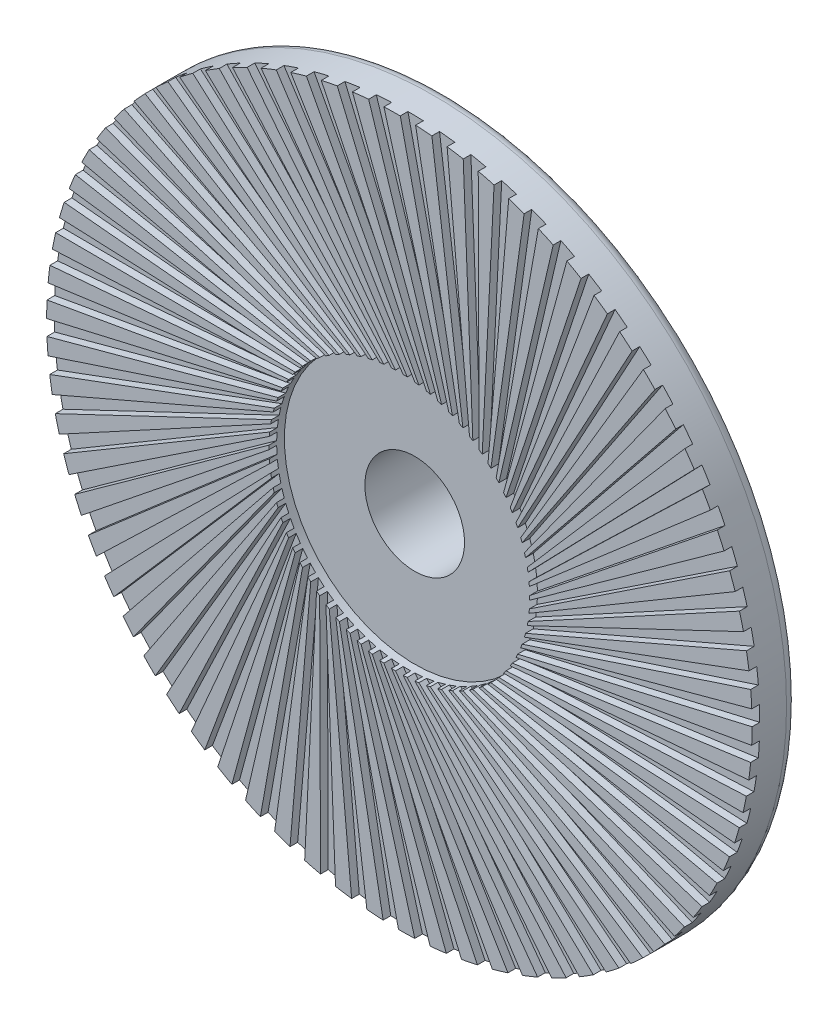
from build123d import *

# Parameters (mm, degrees)
CROQUIS1_R              = 46
SALIENTE_EXTRUIR1_DEPTH = 6
CORTAR_EXTRUIR1_START   = -1
CORTAR_EXTRUIR1_DEPTH   = 1
MATRIZC1_COUNT          = 70
CORTAR_EXTRUIR2_START   = -2
CROQUIS3_R              = 17
CORTAR_EXTRUIR2_DEPTH   = 2
CROQUIS4_R              = 14
SALIENTE_EXTRUIR2_DEPTH = 7
CROQUIS5_R              = 6.5
CORTAR_EXTRUIR3_DEPTH   = 67.340033162
REDONDEO1_R             = 2
CROQUIS6_R              = 1.5
CORTAR_EXTRUIR5_DEPTH   = 15
REDONDEO2_R             = 1.5
REDONDEO3_R             = 1.5
MATRIZC2_COUNT          = 2
MATRIZC2_ANGLE          = 90


with BuildPart() as part:
    # Croquis1 → Saliente-Extruir1 (new body)
    with BuildSketch(Plane.XY):
        Circle(CROQUIS1_R)
    extrude(amount=SALIENTE_EXTRUIR1_DEPTH)

    # Croquis2 → Cortar-Extruir1 (cut)
    with BuildSketch(Plane.XY.offset(6).offset(CORTAR_EXTRUIR1_START)):
        with BuildLine():
            Line((-0.5, 18.359265396), (-18.031751212, 42.318505978))
            ThreePointArc((-18.031751212, 42.318505978), (-18.947457419, 41.916510558), (-19.854208193, 41.494703482))
            Line((-19.854208193, 41.494703482), (-0.5, 16.992645468))
            ThreePointArc((-0.5, 16.992645468), (0, 17), (0.5, 16.992645468))
            Line((0.5, 16.992645468), (-0.5, 18.359265396))
        make_face()
    cortar_extruir1 = extrude(amount=CORTAR_EXTRUIR1_DEPTH, mode=Mode.SUBTRACT)

    # MatrizC1: Cortar-Extruir1 ×70 about axis
    matrizc1_axis = Axis((0, 0, 0), (0, 0, 1))
    for i in range(1, MATRIZC1_COUNT):
        add(cortar_extruir1.rotate(matrizc1_axis, i * 360 / MATRIZC1_COUNT), mode=Mode.SUBTRACT)

    # Croquis3 → Cortar-Extruir2 (cut)
    with BuildSketch(Plane.XY.offset(6).offset(CORTAR_EXTRUIR2_START)):
        Circle(CROQUIS3_R)
    extrude(amount=CORTAR_EXTRUIR2_DEPTH, mode=Mode.SUBTRACT)

    # Croquis4 → Saliente-Extruir2 (add)
    with BuildSketch(Plane(origin=(0, 0, 0), x_dir=(-1, 0, 0), z_dir=(0, 0, -1))):
        with Locations(Location((0, 0, 0), (0, 0, 180))):
            Circle(CROQUIS4_R)
    extrude(amount=SALIENTE_EXTRUIR2_DEPTH)

    # Croquis5 → Cortar-Extruir3 (cut, through all)
    with BuildSketch(Plane(origin=(0, 0, -7), x_dir=(-1, 0, 0), z_dir=(0, 0, -1))):
        Circle(CROQUIS5_R)
    extrude(amount=-CORTAR_EXTRUIR3_DEPTH, mode=Mode.SUBTRACT)

    # Redondeo1
    redondeo1_edges = [part.edges().sort_by_distance(p)[0] for p in [
        (-14, 0, -7),
    ]]
    fillet(redondeo1_edges, radius=REDONDEO1_R)

    # Croquis6 → Cortar-Extruir5 (cut, symmetric)
    with BuildSketch(Plane(origin=(0, 0, 0), x_dir=(0, 0, -1), z_dir=(1, 0, 0))):
        with Locations((7, 0)):
            Circle(CROQUIS6_R)
    cortar_extruir5 = extrude(amount=CORTAR_EXTRUIR5_DEPTH, both=True, mode=Mode.SUBTRACT)

    # Redondeo2
    redondeo2_edges = [part.edges().sort_by_distance(p)[0] for p in [
        (-46, 0, 0),
    ]]
    fillet(redondeo2_edges, radius=REDONDEO2_R)

    # Redondeo3
    redondeo3_edges = [part.edges().sort_by_distance(p)[0] for p in [
        (-14, 0, 0),
    ]]
    fillet(redondeo3_edges, radius=REDONDEO3_R)

    # MatrizC2: Cortar-Extruir5 ×2 about axis
    matrizc2_axis = Axis((0, 0, -1.5), (0, 0, 1))
    for i in range(1, MATRIZC2_COUNT):
        add(cortar_extruir5.rotate(matrizc2_axis, i * MATRIZC2_ANGLE / (MATRIZC2_COUNT - 1)), mode=Mode.SUBTRACT)


solid = part.part
